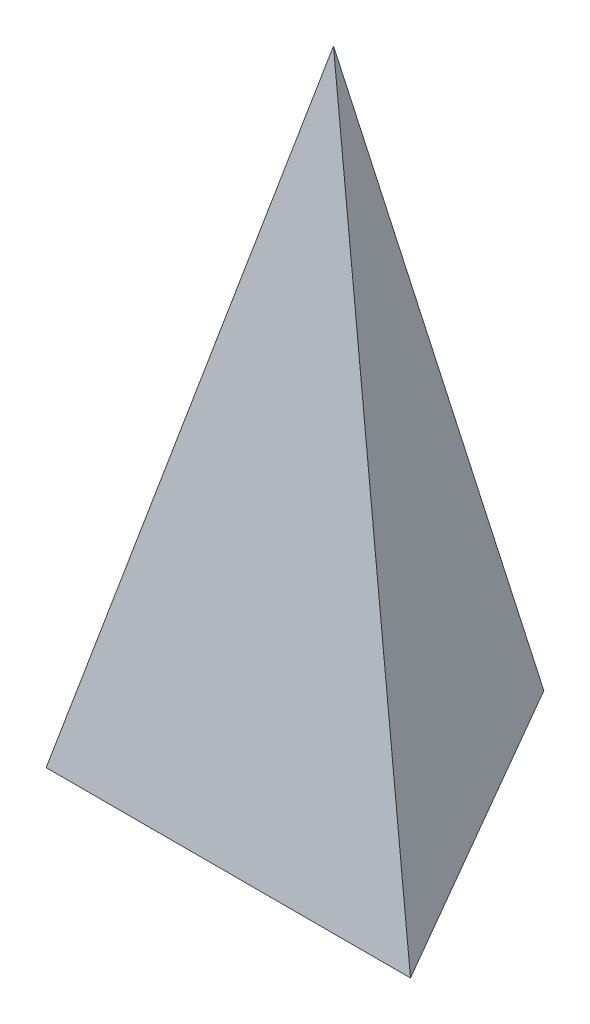
from build123d import *


with BuildPart() as part:
    # Sketch1 → Loft1 section 0
    with BuildSketch(Plane(origin=(0, 0, 0), x_dir=(1, 0, 0), z_dir=(0, 1, 0)), mode=Mode.PRIVATE) as loft1_s0:
        with BuildLine():
            Line((0, 27.770666667), (-24.050102813, -13.885333333))
            Line((-24.050102813, -13.885333333), (24.050102813, -13.885333333))
            Line((24.050102813, -13.885333333), (0, 27.770666667))
        make_face()
    loft([Vertex(0, 87.600091711, 0), loft1_s0.sketch])


solid = part.part
